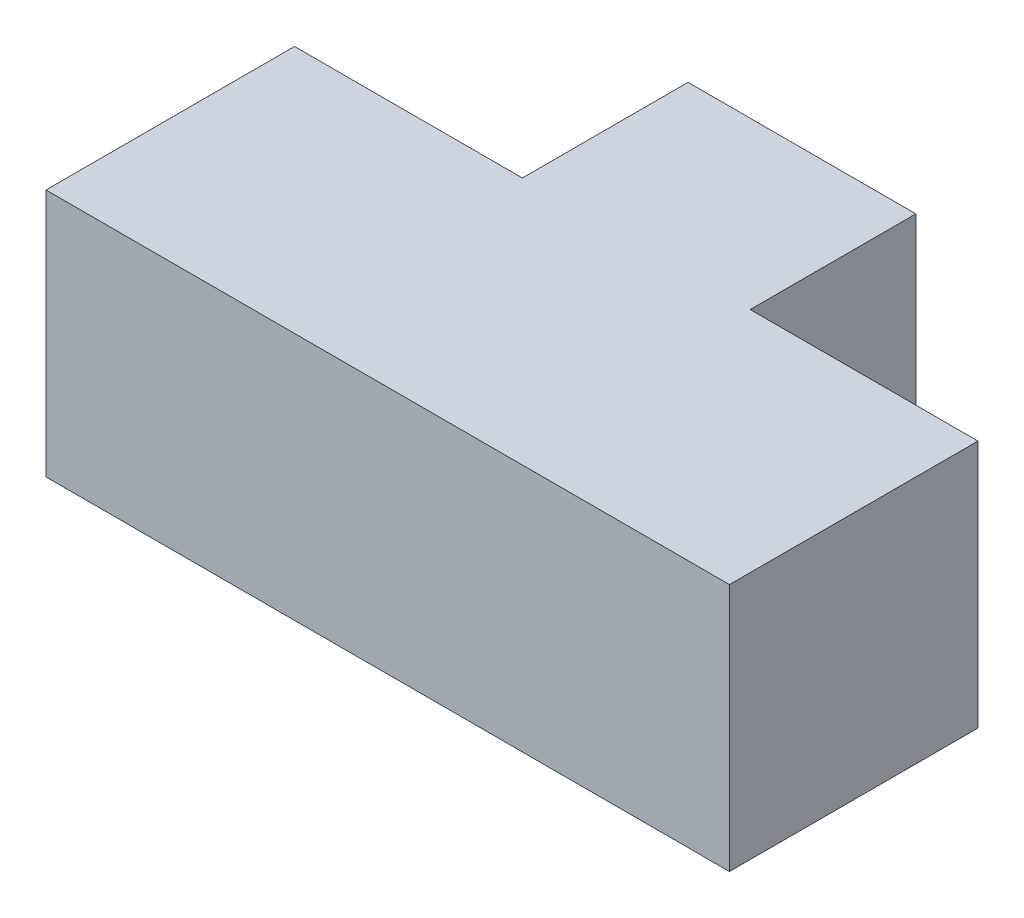
from build123d import *

# Parameters (mm, degrees)
BOSS_EXTRUDE1_DEPTH = 76.2


with BuildPart() as part:
    # Sketch1 → Boss-Extrude1 (new body)
    with BuildSketch(Plane(origin=(0, 0, 0), x_dir=(1, 0, 0), z_dir=(0, 1, 0))):
        Polygon((0, 0), (209.55, 0), (209.55, 76.2), (139.7, 76.2), (139.7, 127), (69.85, 127), (69.85, 76.2), (0, 76.2), align=None)
    extrude(amount=BOSS_EXTRUDE1_DEPTH)


solid = part.part
